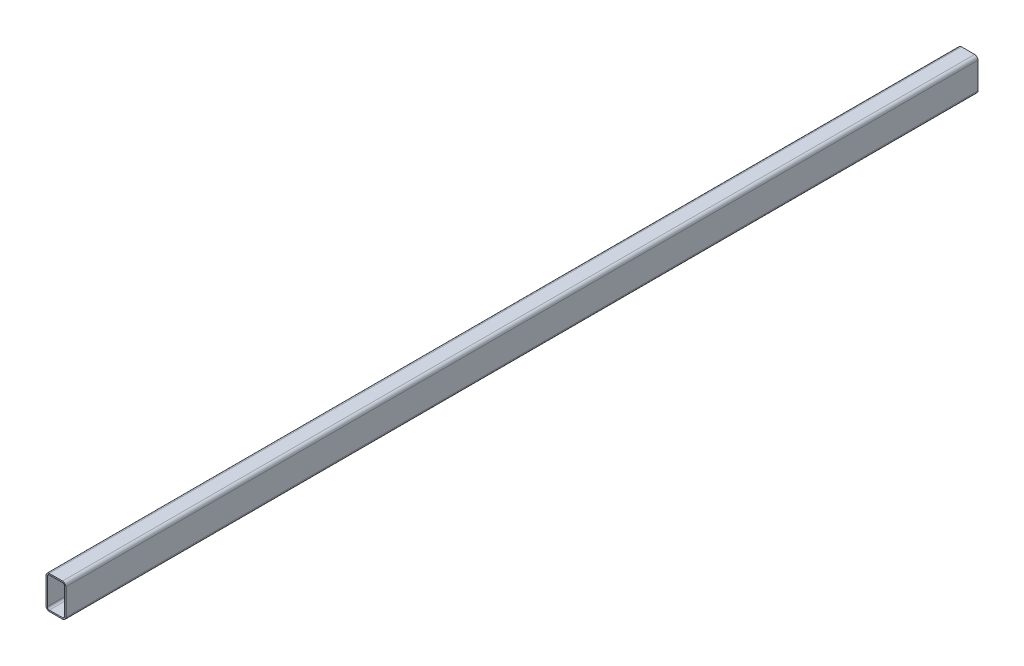
from build123d import *

# Parameters (mm, degrees)
BOSS_EXTRUDE1_DEPTH = 1725


with BuildPart() as part:
    # Sketch1 → Boss-Extrude1 (new, symmetric)
    with BuildSketch(Plane.XY):
        with BuildLine():
            Line((-37.5, 0), (-37.5, -50))
            ThreePointArc((-37.5, -50), (-33.838834765, -58.838834765), (-25, -62.5))
            Line((-25, -62.5), (0, -62.5))
            Line((0, -62.5), (25, -62.5))
            ThreePointArc((25, -62.5), (33.838834765, -58.838834765), (37.5, -50))
            Line((37.5, -50), (37.5, 0))
            Line((37.5, 0), (37.5, 50))
            ThreePointArc((37.5, 50), (33.838834765, 58.838834765), (25, 62.5))
            Line((25, 62.5), (-25, 62.5))
            ThreePointArc((-25, 62.5), (-33.838834765, 58.838834765), (-37.5, 50))
            Line((-37.5, 50), (-37.5, 0))
        make_face()
        with BuildLine():
            Line((-32.5, 0), (-32.5, -50))
            ThreePointArc((-32.5, -50), (-30.303300859, -55.303300859), (-25, -57.5))
            Line((-25, -57.5), (0, -57.5))
            Line((0, -57.5), (25, -57.5))
            ThreePointArc((25, -57.5), (30.303300859, -55.303300859), (32.5, -50))
            Line((32.5, -50), (32.5, 0))
            Line((32.5, 0), (32.5, 50))
            ThreePointArc((32.5, 50), (30.303300859, 55.303300859), (25, 57.5))
            Line((25, 57.5), (-25, 57.5))
            ThreePointArc((-25, 57.5), (-30.303300859, 55.303300859), (-32.5, 50))
            Line((-32.5, 50), (-32.5, 0))
        make_face(mode=Mode.SUBTRACT)
    extrude(amount=BOSS_EXTRUDE1_DEPTH, both=True)


solid = part.part
